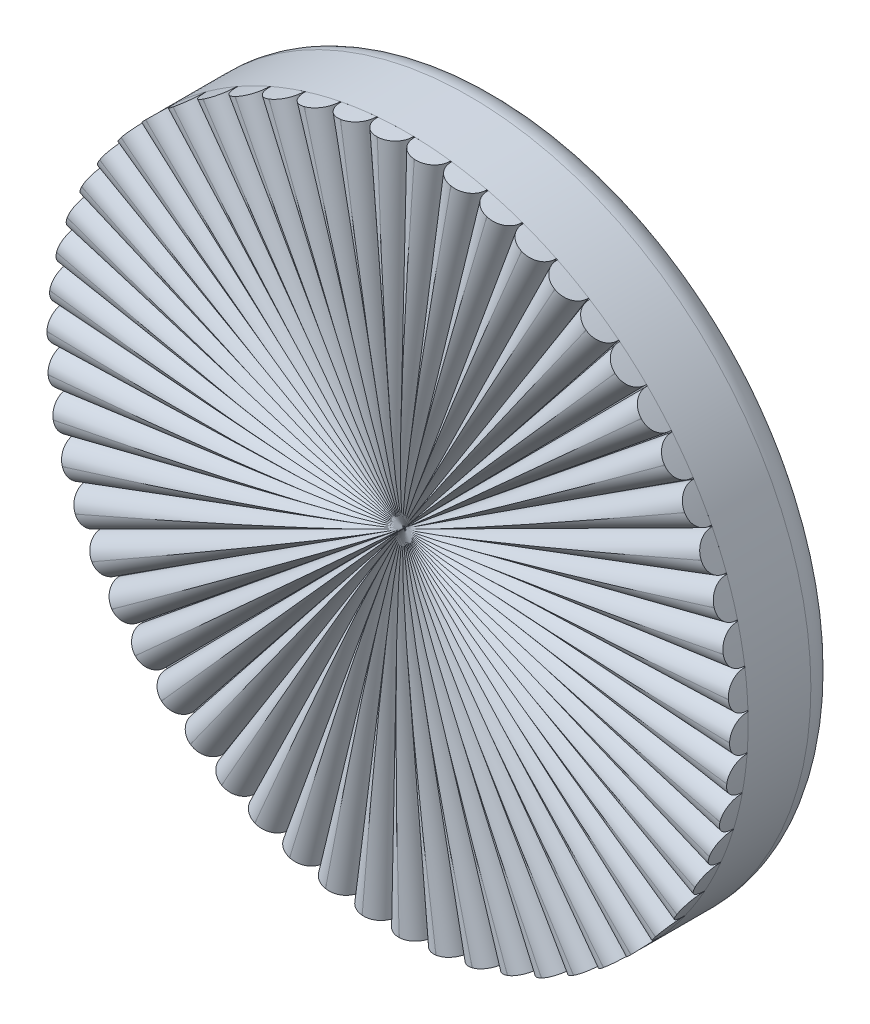
from build123d import *

# Parameters (mm, degrees)
SKETCH1_R           = 92.5
BOSS_EXTRUDE1_DEPTH = 25
BOSS_EXTRUDE2_DEPTH = 5
FILLET1_R           = 4.75
CIRPATTERN1_COUNT   = 58
FILLET2_R           = 8


with BuildPart() as part:
    # Sketch1 → Boss-Extrude1 (new body)
    with BuildSketch(Plane.XY):
        Circle(SKETCH1_R)
    extrude(amount=BOSS_EXTRUDE1_DEPTH)

    # Fillet2
    fillet2_edges = [part.edges().sort_by_distance(p)[0] for p in [
        (-92.5, 0, 0),
    ]]
    fillet(fillet2_edges, radius=FILLET2_R)


with BuildPart() as body_2:
    # Sketch2 → Boss-Extrude2 (new body)
    with BuildSketch(Plane.XY.offset(25)):
        with BuildLine():
            Line((0, 0), (31.634970794, 86.9222562))
            ThreePointArc((31.634970794, 86.9222562), (36.135232558, 85.149838332), (40.536696232, 83.14461052))
            Line((40.536696232, 83.14461052), (0, 0))
        make_face()
    extrude(amount=BOSS_EXTRUDE2_DEPTH)

    # Fillet1
    fillet1_edges = [body_2.edges().sort_by_distance(p)[0] for p in [
        (15.817485397, 43.4611281, 30),
        (20.268348116, 41.57230526, 30),
    ]]
    fillet(fillet1_edges, radius=FILLET1_R)


with BuildPart() as cirpattern1_1:
    # CirPattern1: pattern copy
    add(body_2.part.rotate(Axis((0, 0, 0), (0, 0, 1)), 1 * 360 / CIRPATTERN1_COUNT))


with BuildPart() as cirpattern1_2:
    # CirPattern1: pattern copy
    add(body_2.part.rotate(Axis((0, 0, 0), (0, 0, 1)), 2 * 360 / CIRPATTERN1_COUNT))


with BuildPart() as cirpattern1_3:
    # CirPattern1: pattern copy
    add(body_2.part.rotate(Axis((0, 0, 0), (0, 0, 1)), 3 * 360 / CIRPATTERN1_COUNT))


with BuildPart() as cirpattern1_4:
    # CirPattern1: pattern copy
    add(body_2.part.rotate(Axis((0, 0, 0), (0, 0, 1)), 4 * 360 / CIRPATTERN1_COUNT))


with BuildPart() as cirpattern1_5:
    # CirPattern1: pattern copy
    add(body_2.part.rotate(Axis((0, 0, 0), (0, 0, 1)), 5 * 360 / CIRPATTERN1_COUNT))


with BuildPart() as cirpattern1_6:
    # CirPattern1: pattern copy
    add(body_2.part.rotate(Axis((0, 0, 0), (0, 0, 1)), 6 * 360 / CIRPATTERN1_COUNT))


with BuildPart() as cirpattern1_7:
    # CirPattern1: pattern copy
    add(body_2.part.rotate(Axis((0, 0, 0), (0, 0, 1)), 7 * 360 / CIRPATTERN1_COUNT))


with BuildPart() as cirpattern1_8:
    # CirPattern1: pattern copy
    add(body_2.part.rotate(Axis((0, 0, 0), (0, 0, 1)), 8 * 360 / CIRPATTERN1_COUNT))


with BuildPart() as cirpattern1_9:
    # CirPattern1: pattern copy
    add(body_2.part.rotate(Axis((0, 0, 0), (0, 0, 1)), 9 * 360 / CIRPATTERN1_COUNT))


with BuildPart() as cirpattern1_10:
    # CirPattern1: pattern copy
    add(body_2.part.rotate(Axis((0, 0, 0), (0, 0, 1)), 10 * 360 / CIRPATTERN1_COUNT))


with BuildPart() as cirpattern1_11:
    # CirPattern1: pattern copy
    add(body_2.part.rotate(Axis((0, 0, 0), (0, 0, 1)), 11 * 360 / CIRPATTERN1_COUNT))


with BuildPart() as cirpattern1_12:
    # CirPattern1: pattern copy
    add(body_2.part.rotate(Axis((0, 0, 0), (0, 0, 1)), 12 * 360 / CIRPATTERN1_COUNT))


with BuildPart() as cirpattern1_13:
    # CirPattern1: pattern copy
    add(body_2.part.rotate(Axis((0, 0, 0), (0, 0, 1)), 13 * 360 / CIRPATTERN1_COUNT))


with BuildPart() as cirpattern1_14:
    # CirPattern1: pattern copy
    add(body_2.part.rotate(Axis((0, 0, 0), (0, 0, 1)), 14 * 360 / CIRPATTERN1_COUNT))


with BuildPart() as cirpattern1_15:
    # CirPattern1: pattern copy
    add(body_2.part.rotate(Axis((0, 0, 0), (0, 0, 1)), 15 * 360 / CIRPATTERN1_COUNT))


with BuildPart() as cirpattern1_16:
    # CirPattern1: pattern copy
    add(body_2.part.rotate(Axis((0, 0, 0), (0, 0, 1)), 16 * 360 / CIRPATTERN1_COUNT))


with BuildPart() as cirpattern1_17:
    # CirPattern1: pattern copy
    add(body_2.part.rotate(Axis((0, 0, 0), (0, 0, 1)), 17 * 360 / CIRPATTERN1_COUNT))


with BuildPart() as cirpattern1_18:
    # CirPattern1: pattern copy
    add(body_2.part.rotate(Axis((0, 0, 0), (0, 0, 1)), 18 * 360 / CIRPATTERN1_COUNT))


with BuildPart() as cirpattern1_19:
    # CirPattern1: pattern copy
    add(body_2.part.rotate(Axis((0, 0, 0), (0, 0, 1)), 19 * 360 / CIRPATTERN1_COUNT))


with BuildPart() as cirpattern1_20:
    # CirPattern1: pattern copy
    add(body_2.part.rotate(Axis((0, 0, 0), (0, 0, 1)), 20 * 360 / CIRPATTERN1_COUNT))


with BuildPart() as cirpattern1_21:
    # CirPattern1: pattern copy
    add(body_2.part.rotate(Axis((0, 0, 0), (0, 0, 1)), 21 * 360 / CIRPATTERN1_COUNT))


with BuildPart() as cirpattern1_22:
    # CirPattern1: pattern copy
    add(body_2.part.rotate(Axis((0, 0, 0), (0, 0, 1)), 22 * 360 / CIRPATTERN1_COUNT))


with BuildPart() as cirpattern1_23:
    # CirPattern1: pattern copy
    add(body_2.part.rotate(Axis((0, 0, 0), (0, 0, 1)), 23 * 360 / CIRPATTERN1_COUNT))


with BuildPart() as cirpattern1_24:
    # CirPattern1: pattern copy
    add(body_2.part.rotate(Axis((0, 0, 0), (0, 0, 1)), 24 * 360 / CIRPATTERN1_COUNT))


with BuildPart() as cirpattern1_25:
    # CirPattern1: pattern copy
    add(body_2.part.rotate(Axis((0, 0, 0), (0, 0, 1)), 25 * 360 / CIRPATTERN1_COUNT))


with BuildPart() as cirpattern1_26:
    # CirPattern1: pattern copy
    add(body_2.part.rotate(Axis((0, 0, 0), (0, 0, 1)), 26 * 360 / CIRPATTERN1_COUNT))


with BuildPart() as cirpattern1_27:
    # CirPattern1: pattern copy
    add(body_2.part.rotate(Axis((0, 0, 0), (0, 0, 1)), 27 * 360 / CIRPATTERN1_COUNT))


with BuildPart() as cirpattern1_28:
    # CirPattern1: pattern copy
    add(body_2.part.rotate(Axis((0, 0, 0), (0, 0, 1)), 28 * 360 / CIRPATTERN1_COUNT))


with BuildPart() as cirpattern1_29:
    # CirPattern1: pattern copy
    add(body_2.part.rotate(Axis((0, 0, 0), (0, 0, 1)), 29 * 360 / CIRPATTERN1_COUNT))


with BuildPart() as cirpattern1_30:
    # CirPattern1: pattern copy
    add(body_2.part.rotate(Axis((0, 0, 0), (0, 0, 1)), 30 * 360 / CIRPATTERN1_COUNT))


with BuildPart() as cirpattern1_31:
    # CirPattern1: pattern copy
    add(body_2.part.rotate(Axis((0, 0, 0), (0, 0, 1)), 31 * 360 / CIRPATTERN1_COUNT))


with BuildPart() as cirpattern1_32:
    # CirPattern1: pattern copy
    add(body_2.part.rotate(Axis((0, 0, 0), (0, 0, 1)), 32 * 360 / CIRPATTERN1_COUNT))


with BuildPart() as cirpattern1_33:
    # CirPattern1: pattern copy
    add(body_2.part.rotate(Axis((0, 0, 0), (0, 0, 1)), 33 * 360 / CIRPATTERN1_COUNT))


with BuildPart() as cirpattern1_34:
    # CirPattern1: pattern copy
    add(body_2.part.rotate(Axis((0, 0, 0), (0, 0, 1)), 34 * 360 / CIRPATTERN1_COUNT))


with BuildPart() as cirpattern1_35:
    # CirPattern1: pattern copy
    add(body_2.part.rotate(Axis((0, 0, 0), (0, 0, 1)), 35 * 360 / CIRPATTERN1_COUNT))


with BuildPart() as cirpattern1_36:
    # CirPattern1: pattern copy
    add(body_2.part.rotate(Axis((0, 0, 0), (0, 0, 1)), 36 * 360 / CIRPATTERN1_COUNT))


with BuildPart() as cirpattern1_37:
    # CirPattern1: pattern copy
    add(body_2.part.rotate(Axis((0, 0, 0), (0, 0, 1)), 37 * 360 / CIRPATTERN1_COUNT))


with BuildPart() as cirpattern1_38:
    # CirPattern1: pattern copy
    add(body_2.part.rotate(Axis((0, 0, 0), (0, 0, 1)), 38 * 360 / CIRPATTERN1_COUNT))


with BuildPart() as cirpattern1_39:
    # CirPattern1: pattern copy
    add(body_2.part.rotate(Axis((0, 0, 0), (0, 0, 1)), 39 * 360 / CIRPATTERN1_COUNT))


with BuildPart() as cirpattern1_40:
    # CirPattern1: pattern copy
    add(body_2.part.rotate(Axis((0, 0, 0), (0, 0, 1)), 40 * 360 / CIRPATTERN1_COUNT))


with BuildPart() as cirpattern1_41:
    # CirPattern1: pattern copy
    add(body_2.part.rotate(Axis((0, 0, 0), (0, 0, 1)), 41 * 360 / CIRPATTERN1_COUNT))


with BuildPart() as cirpattern1_42:
    # CirPattern1: pattern copy
    add(body_2.part.rotate(Axis((0, 0, 0), (0, 0, 1)), 42 * 360 / CIRPATTERN1_COUNT))


with BuildPart() as cirpattern1_43:
    # CirPattern1: pattern copy
    add(body_2.part.rotate(Axis((0, 0, 0), (0, 0, 1)), 43 * 360 / CIRPATTERN1_COUNT))


with BuildPart() as cirpattern1_44:
    # CirPattern1: pattern copy
    add(body_2.part.rotate(Axis((0, 0, 0), (0, 0, 1)), 44 * 360 / CIRPATTERN1_COUNT))


with BuildPart() as cirpattern1_45:
    # CirPattern1: pattern copy
    add(body_2.part.rotate(Axis((0, 0, 0), (0, 0, 1)), 45 * 360 / CIRPATTERN1_COUNT))


with BuildPart() as cirpattern1_46:
    # CirPattern1: pattern copy
    add(body_2.part.rotate(Axis((0, 0, 0), (0, 0, 1)), 46 * 360 / CIRPATTERN1_COUNT))


with BuildPart() as cirpattern1_47:
    # CirPattern1: pattern copy
    add(body_2.part.rotate(Axis((0, 0, 0), (0, 0, 1)), 47 * 360 / CIRPATTERN1_COUNT))


with BuildPart() as cirpattern1_48:
    # CirPattern1: pattern copy
    add(body_2.part.rotate(Axis((0, 0, 0), (0, 0, 1)), 48 * 360 / CIRPATTERN1_COUNT))


with BuildPart() as cirpattern1_49:
    # CirPattern1: pattern copy
    add(body_2.part.rotate(Axis((0, 0, 0), (0, 0, 1)), 49 * 360 / CIRPATTERN1_COUNT))


with BuildPart() as cirpattern1_50:
    # CirPattern1: pattern copy
    add(body_2.part.rotate(Axis((0, 0, 0), (0, 0, 1)), 50 * 360 / CIRPATTERN1_COUNT))


with BuildPart() as cirpattern1_51:
    # CirPattern1: pattern copy
    add(body_2.part.rotate(Axis((0, 0, 0), (0, 0, 1)), 51 * 360 / CIRPATTERN1_COUNT))


with BuildPart() as cirpattern1_52:
    # CirPattern1: pattern copy
    add(body_2.part.rotate(Axis((0, 0, 0), (0, 0, 1)), 52 * 360 / CIRPATTERN1_COUNT))


with BuildPart() as cirpattern1_53:
    # CirPattern1: pattern copy
    add(body_2.part.rotate(Axis((0, 0, 0), (0, 0, 1)), 53 * 360 / CIRPATTERN1_COUNT))


with BuildPart() as cirpattern1_54:
    # CirPattern1: pattern copy
    add(body_2.part.rotate(Axis((0, 0, 0), (0, 0, 1)), 54 * 360 / CIRPATTERN1_COUNT))


with BuildPart() as cirpattern1_55:
    # CirPattern1: pattern copy
    add(body_2.part.rotate(Axis((0, 0, 0), (0, 0, 1)), 55 * 360 / CIRPATTERN1_COUNT))


with BuildPart() as cirpattern1_56:
    # CirPattern1: pattern copy
    add(body_2.part.rotate(Axis((0, 0, 0), (0, 0, 1)), 56 * 360 / CIRPATTERN1_COUNT))


with BuildPart() as cirpattern1_57:
    # CirPattern1: pattern copy
    add(body_2.part.rotate(Axis((0, 0, 0), (0, 0, 1)), 57 * 360 / CIRPATTERN1_COUNT))


solid = Compound([part.part, body_2.part, cirpattern1_1.part, cirpattern1_2.part, cirpattern1_3.part, cirpattern1_4.part, cirpattern1_5.part, cirpattern1_6.part, cirpattern1_7.part, cirpattern1_8.part, cirpattern1_9.part, cirpattern1_10.part, cirpattern1_11.part, cirpattern1_12.part, cirpattern1_13.part, cirpattern1_14.part, cirpattern1_15.part, cirpattern1_16.part, cirpattern1_17.part, cirpattern1_18.part, cirpattern1_19.part, cirpattern1_20.part, cirpattern1_21.part, cirpattern1_22.part, cirpattern1_23.part, cirpattern1_24.part, cirpattern1_25.part, cirpattern1_26.part, cirpattern1_27.part, cirpattern1_28.part, cirpattern1_29.part, cirpattern1_30.part, cirpattern1_31.part, cirpattern1_32.part, cirpattern1_33.part, cirpattern1_34.part, cirpattern1_35.part, cirpattern1_36.part, cirpattern1_37.part, cirpattern1_38.part, cirpattern1_39.part, cirpattern1_40.part, cirpattern1_41.part, cirpattern1_42.part, cirpattern1_43.part, cirpattern1_44.part, cirpattern1_45.part, cirpattern1_46.part, cirpattern1_47.part, cirpattern1_48.part, cirpattern1_49.part, cirpattern1_50.part, cirpattern1_51.part, cirpattern1_52.part, cirpattern1_53.part, cirpattern1_54.part, cirpattern1_55.part, cirpattern1_56.part, cirpattern1_57.part])
